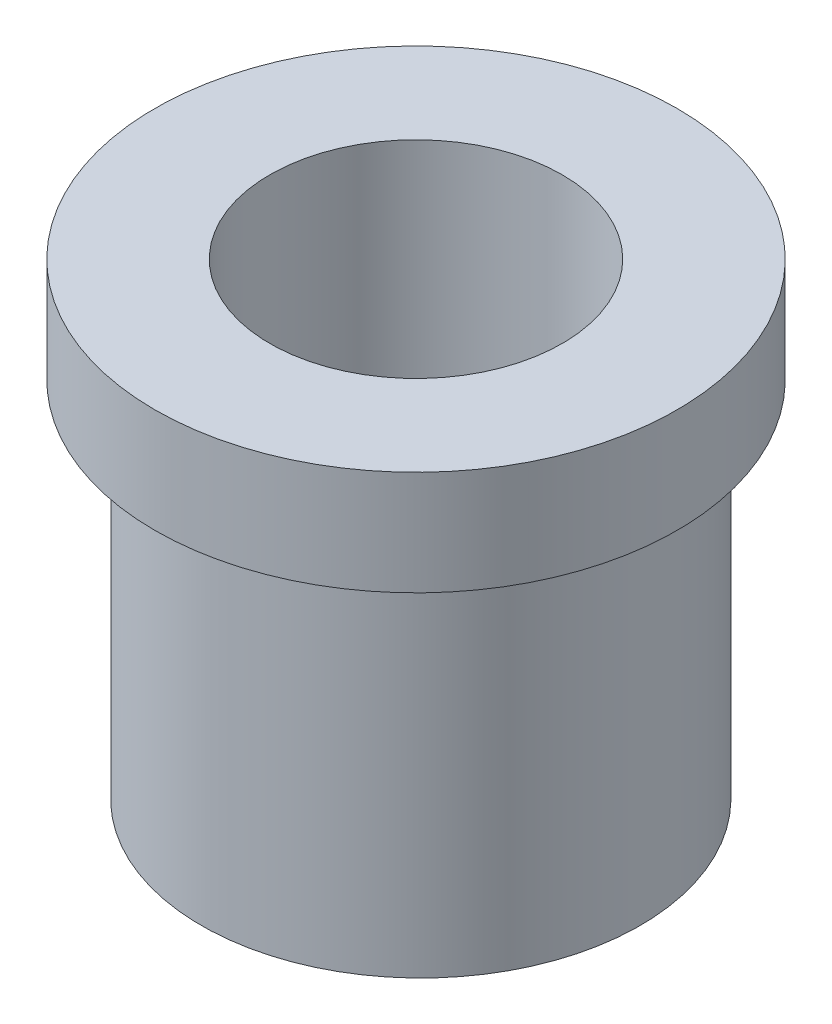
from build123d import *

# Parameters (mm, degrees)
SKETCH_1_R      = 21
SKETCH_1_R_2    = 14
EXTRUDE_1_DEPTH = 45
EXTRUDE_START   = -10
SKETCH_2_R      = 25
SKETCH_2_R_2    = 14
EXTRUDE_2_DEPTH = 10


with BuildPart() as part:
    # 草图1 → 凸台-拉伸1 (new body)
    with BuildSketch(Plane(origin=(0, 0, 0), x_dir=(1, 0, 0), z_dir=(0, 1, 0))):
        with Locations(Location((0, 0.455240015, 0), (0, 0, 90))):
            Circle(SKETCH_1_R)
        with Locations(Location((0, 0, 0), (0, 0, 90))):
            Circle(SKETCH_1_R_2, mode=Mode.SUBTRACT)
    extrude(amount=EXTRUDE_1_DEPTH)

    # 草图2 → 凸台-拉伸2 (add)
    with BuildSketch(Plane(origin=(0, 45, 0), x_dir=(1, 0, 0), z_dir=(0, 1, 0)).offset(EXTRUDE_START)):
        with Locations(Location((0, 0, 0), (0, 0, 270))):
            Circle(SKETCH_2_R)
        with Locations(Location((0, 0, 0), (0, 0, 90))):
            Circle(SKETCH_2_R_2, mode=Mode.SUBTRACT)
    extrude(amount=EXTRUDE_2_DEPTH)


solid = part.part
